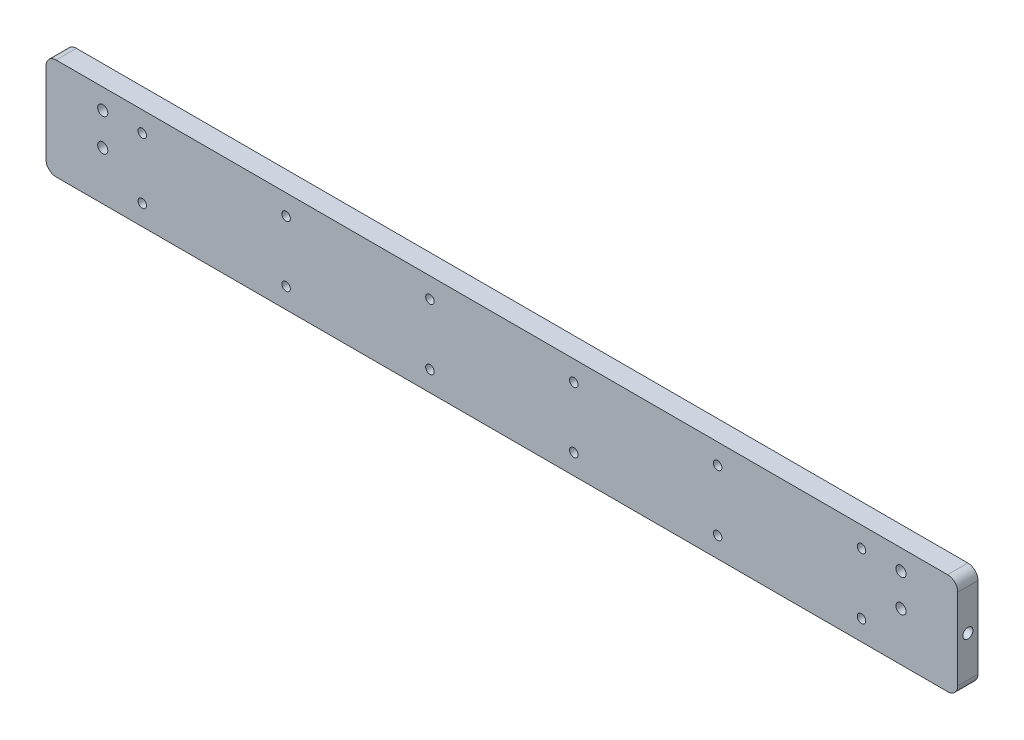
from build123d import *

# Parameters (mm, degrees)
ESQUISSE1_W                  = 450
ESQUISSE1_H                  = 50
BOSS_EXTRU_1_DEPTH           = 10
ESQUISSE2_R                  = 2.5
ENL_V_MAT_EXTRU_1_DEPTH      = 16
ENL_V_START                  = -430
ESQUISSE2_2_R                = 2.5
ENL_V_MAT_EXTRU_2_DEPTH      = 20
CONG_1_R                     = 5
ENL_V_MAT_EXTRU_3_DEPTH      = 453.879674969
ENL_V_MAT_EXTRU_3_DEPTH_BACK = 453.879674969
ESQUISSE3_R                  = 2.1
ENL_V_MAT_EXTRU_4_DEPTH      = 453.879674969
ENL_V_MAT_EXTRU_4_DEPTH_BACK = 453.879674969
ESQUISSE4_R                  = 2.5


with BuildPart() as part:
    # Esquisse1 → Boss.-Extru.1 (new body)
    with BuildSketch(Plane.XY):
        with Locations((225, 25)):
            Rectangle(ESQUISSE1_W, ESQUISSE1_H)
    extrude(amount=BOSS_EXTRU_1_DEPTH)

    # Esquisse2 → Enlèv. mat.-Extru.1 (cut)
    with BuildSketch(Plane.ZY):
        with Locations((5, 25)):
            Circle(ESQUISSE2_R)
    extrude(amount=-ENL_V_MAT_EXTRU_1_DEPTH, mode=Mode.SUBTRACT)

    # Esquisse2<2> → Enlèv. mat.-Extru.2 (cut)
    with BuildSketch(Plane.ZY.offset(ENL_V_START)):
        with Locations((5, 25)):
            Circle(ESQUISSE2_2_R)
    extrude(amount=-ENL_V_MAT_EXTRU_2_DEPTH, mode=Mode.SUBTRACT)

    # Congé1
    cong_1_edges = [part.edges().sort_by_distance(p)[0] for p in [
        (0, 50, 5),
        (450, 50, 5),
        (450, 0, 5),
        (0, 0, 5),
    ]]
    fillet(cong_1_edges, radius=CONG_1_R)

    # Esquisse3 → Enlèv. mat.-Extru.3 (cut, two sides: drawn at the far end of the back side and taken through both)
    with BuildSketch(Plane(origin=(0, 0, 0), x_dir=(-1, 0, 0), z_dir=(0, 0, -1)).offset(-ENL_V_MAT_EXTRU_3_DEPTH_BACK)):
        with Locations((-260.5, 40)):
            Circle(ESQUISSE3_R)
        with Locations((-260.5, 10)):
            Circle(ESQUISSE3_R)
        with Locations((-331.5, 10)):
            Circle(ESQUISSE3_R)
        with Locations((-331.5, 40)):
            Circle(ESQUISSE3_R)
        with Locations((-402.5, 40)):
            Circle(ESQUISSE3_R)
        with Locations((-402.5, 10)):
            Circle(ESQUISSE3_R)
        with Locations((-47.5, 10)):
            Circle(ESQUISSE3_R)
        with Locations((-47.5, 40)):
            Circle(ESQUISSE3_R)
        with Locations((-118.5, 40)):
            Circle(ESQUISSE3_R)
        with Locations((-118.5, 10)):
            Circle(ESQUISSE3_R)
        with Locations((-189.5, 10)):
            Circle(ESQUISSE3_R)
        with Locations((-189.5, 40)):
            Circle(ESQUISSE3_R)
    extrude(amount=ENL_V_MAT_EXTRU_3_DEPTH + ENL_V_MAT_EXTRU_3_DEPTH_BACK, mode=Mode.SUBTRACT)

    # Esquisse4 → Enlèv. mat.-Extru.4 (cut, two sides: drawn at the far end of the back side and taken through both)
    with BuildSketch(Plane.XY.offset(10).offset(-ENL_V_MAT_EXTRU_4_DEPTH_BACK)):
        with Locations((28, 40)):
            Circle(ESQUISSE4_R)
        with Locations(Location((28, 24, 0), (0, 0, 180))):
            Circle(ESQUISSE4_R)
        with Locations((422, 24)):
            Circle(ESQUISSE4_R)
        with Locations(Location((422, 40, 0), (0, 0, 180))):
            Circle(ESQUISSE4_R)
    extrude(amount=ENL_V_MAT_EXTRU_4_DEPTH + ENL_V_MAT_EXTRU_4_DEPTH_BACK, mode=Mode.SUBTRACT)


solid = part.part
